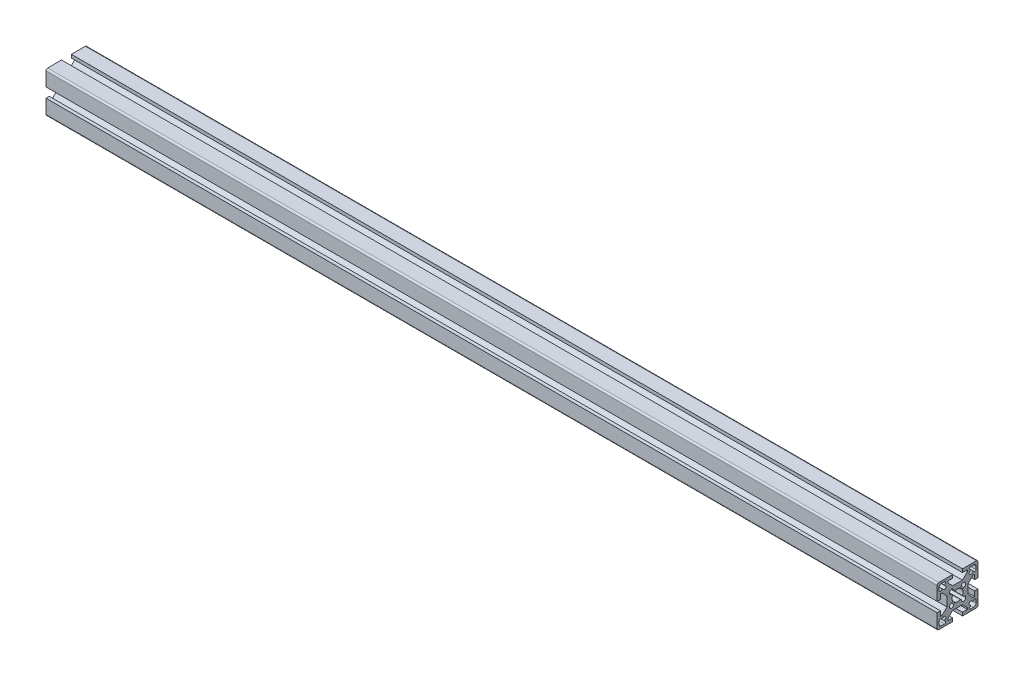
from build123d import *

# Parameters (mm, degrees)
BOSS_EXTRUDE1_DEPTH = 545


with BuildPart() as part:
    # Sketch1 → Boss-Extrude1 (new body)
    with BuildSketch(Plane(origin=(0, 0, 0), x_dir=(0, 0, -1), z_dir=(1, 0, 0))):
        with BuildLine():
            Line((-12.5, 11.5), (-12.5, 3))
            Line((-12.5, 3), (-10.5, 3))
            Line((-10.5, 3), (-10.5, 6))
            Line((-10.5, 6), (-9.535533906, 6))
            Line((-9.535533906, 6), (-6.5, 2.964466094))
            Line((-6.5, 2.964466094), (-6.5, -2.964466094))
            Line((-6.5, -2.964466094), (-9.535533906, -6))
            Line((-9.535533906, -6), (-10.5, -6))
            Line((-10.5, -6), (-10.5, -3))
            Line((-10.5, -3), (-12.5, -3))
            Line((-12.5, -3), (-12.5, -11.5))
            ThreePointArc((-12.5, -11.5), (-12.207106781, -12.207106781), (-11.5, -12.5))
            Line((-11.5, -12.5), (-3, -12.5))
            Line((-3, -12.5), (-3, -10.5))
            Line((-3, -10.5), (-6, -10.5))
            Line((-6, -10.5), (-6, -9.535533906))
            Line((-6, -9.535533906), (-2.964466094, -6.5))
            Line((-2.964466094, -6.5), (2.964466094, -6.5))
            Line((2.964466094, -6.5), (6, -9.535533906))
            Line((6, -9.535533906), (6, -10.5))
            Line((6, -10.5), (3, -10.5))
            Line((3, -10.5), (3, -12.5))
            Line((3, -12.5), (11.5, -12.5))
            ThreePointArc((11.5, -12.5), (12.207106781, -12.207106781), (12.5, -11.5))
            Line((12.5, -11.5), (12.5, -3))
            Line((12.5, -3), (10.5, -3))
            Line((10.5, -3), (10.5, -6))
            Line((10.5, -6), (9.535533906, -6))
            Line((9.535533906, -6), (6.5, -2.964466094))
            Line((6.5, -2.964466094), (6.5, 2.964466094))
            Line((6.5, 2.964466094), (9.535533906, 6))
            Line((9.535533906, 6), (10.5, 6))
            Line((10.5, 6), (10.5, 3))
            Line((10.5, 3), (12.5, 3))
            Line((12.5, 3), (12.5, 11.5))
            ThreePointArc((12.5, 11.5), (12.207106781, 12.207106781), (11.5, 12.5))
            Line((11.5, 12.5), (3, 12.5))
            Line((3, 12.5), (3, 10.5))
            Line((3, 10.5), (6, 10.5))
            Line((6, 10.5), (6, 9.535533906))
            Line((6, 9.535533906), (2.964466094, 6.5))
            Line((2.964466094, 6.5), (-2.964466094, 6.5))
            Line((-2.964466094, 6.5), (-6, 9.535533906))
            Line((-6, 9.535533906), (-6, 10.5))
            Line((-6, 10.5), (-3, 10.5))
            Line((-3, 10.5), (-3, 12.5))
            Line((-3, 12.5), (-11.5, 12.5))
            ThreePointArc((-11.5, 12.5), (-12.207106781, 12.207106781), (-12.5, 11.5))
        make_face()
        with BuildLine():
            Line((-3.087755464, -1.885673936), (-3.585519377, -2.383437849))
            ThreePointArc((-3.585519377, -2.383437849), (-4.599238816, -4.599238816), (-2.383437849, -3.585519377))
            Line((-2.383437849, -3.585519377), (-1.885673936, -3.087755464))
            ThreePointArc((-1.885673936, -3.087755464), (-1.720751743, -3.0036254), (-1.537849315, -3.032329053))
            ThreePointArc((-1.537849315, -3.032329053), (0, -3.4), (1.537849315, -3.032329053))
            ThreePointArc((1.537849315, -3.032329053), (1.720751743, -3.0036254), (1.885673936, -3.087755464))
            Line((1.885673936, -3.087755464), (2.383437849, -3.585519377))
            ThreePointArc((2.383437849, -3.585519377), (4.599238816, -4.599238816), (3.585519377, -2.383437849))
            Line((3.585519377, -2.383437849), (3.087755464, -1.885673936))
            ThreePointArc((3.087755464, -1.885673936), (3.0036254, -1.720751743), (3.032329053, -1.537849315))
            ThreePointArc((3.032329053, -1.537849315), (3.4, 0), (3.032329053, 1.537849315))
            ThreePointArc((3.032329053, 1.537849315), (3.0036254, 1.720751743), (3.087755464, 1.885673936))
            Line((3.087755464, 1.885673936), (3.585519377, 2.383437849))
            ThreePointArc((3.585519377, 2.383437849), (4.599238816, 4.599238816), (2.383437849, 3.585519377))
            Line((2.383437849, 3.585519377), (1.885673936, 3.087755464))
            ThreePointArc((1.885673936, 3.087755464), (1.720751743, 3.0036254), (1.537849315, 3.032329053))
            ThreePointArc((1.537849315, 3.032329053), (0, 3.4), (-1.537849315, 3.032329053))
            ThreePointArc((-1.537849315, 3.032329053), (-1.720751743, 3.0036254), (-1.885673936, 3.087755464))
            Line((-1.885673936, 3.087755464), (-2.383437849, 3.585519377))
            ThreePointArc((-2.383437849, 3.585519377), (-4.599238816, 4.599238816), (-3.585519377, 2.383437849))
            Line((-3.585519377, 2.383437849), (-3.087755464, 1.885673936))
            ThreePointArc((-3.087755464, 1.885673936), (-3.0036254, 1.720751743), (-3.032329053, 1.537849315))
            ThreePointArc((-3.032329053, 1.537849315), (-3.4, 0), (-3.032329053, -1.537849315))
            ThreePointArc((-3.032329053, -1.537849315), (-3.0036254, -1.720751743), (-3.087755464, -1.885673936))
        make_face(mode=Mode.SUBTRACT)
        with BuildLine():
            Line((-11.25, 9.75), (-11.25, 7.976197667))
            ThreePointArc((-11.25, 7.976197667), (-10.817878403, 7.329481994), (-10.055025253, 7.48122292))
            Line((-10.055025253, 7.48122292), (-9.475230868, 8.061017306))
            Line((-9.475230868, 8.061017306), (-8.768124087, 7.353910524))
            ThreePointArc((-8.768124087, 7.353910524), (-7.353910524, 7.353910524), (-7.353910524, 8.768124087))
            Line((-7.353910524, 8.768124087), (-8.061017306, 9.475230868))
            Line((-8.061017306, 9.475230868), (-7.48122292, 10.055025253))
            ThreePointArc((-7.48122292, 10.055025253), (-7.329481994, 10.817878403), (-7.976197667, 11.25))
            Line((-7.976197667, 11.25), (-9.75, 11.25))
            ThreePointArc((-9.75, 11.25), (-10.810660172, 10.810660172), (-11.25, 9.75))
        make_face(mode=Mode.SUBTRACT)
        with BuildLine():
            Line((8.061017306, 9.475230868), (7.353910524, 8.768124087))
            ThreePointArc((7.353910524, 8.768124087), (7.353910524, 7.353910524), (8.768124087, 7.353910524))
            Line((8.768124087, 7.353910524), (9.475230868, 8.061017306))
            Line((9.475230868, 8.061017306), (10.055025253, 7.48122292))
            ThreePointArc((10.055025253, 7.48122292), (10.817878403, 7.329481994), (11.25, 7.976197667))
            Line((11.25, 7.976197667), (11.25, 9.75))
            ThreePointArc((11.25, 9.75), (10.810660172, 10.810660172), (9.75, 11.25))
            Line((9.75, 11.25), (7.976197667, 11.25))
            ThreePointArc((7.976197667, 11.25), (7.329481994, 10.817878403), (7.48122292, 10.055025253))
            Line((7.48122292, 10.055025253), (8.061017306, 9.475230868))
        make_face(mode=Mode.SUBTRACT)
        with BuildLine():
            Line((-9.475230868, -8.061017306), (-10.055025253, -7.48122292))
            ThreePointArc((-10.055025253, -7.48122292), (-10.817878403, -7.329481994), (-11.25, -7.976197667))
            Line((-11.25, -7.976197667), (-11.25, -9.75))
            ThreePointArc((-11.25, -9.75), (-10.810660172, -10.810660172), (-9.75, -11.25))
            Line((-9.75, -11.25), (-7.976197667, -11.25))
            ThreePointArc((-7.976197667, -11.25), (-7.329481994, -10.817878403), (-7.48122292, -10.055025253))
            Line((-7.48122292, -10.055025253), (-8.061017306, -9.475230868))
            Line((-8.061017306, -9.475230868), (-7.353910524, -8.768124087))
            ThreePointArc((-7.353910524, -8.768124087), (-7.353910524, -7.353910524), (-8.768124087, -7.353910524))
            Line((-8.768124087, -7.353910524), (-9.475230868, -8.061017306))
        make_face(mode=Mode.SUBTRACT)
        with BuildLine():
            Line((9.475230868, -8.061017306), (8.768124087, -7.353910524))
            ThreePointArc((8.768124087, -7.353910524), (7.353910524, -7.353910524), (7.353910524, -8.768124087))
            Line((7.353910524, -8.768124087), (8.061017306, -9.475230868))
            Line((8.061017306, -9.475230868), (7.48122292, -10.055025253))
            ThreePointArc((7.48122292, -10.055025253), (7.329481994, -10.817878403), (7.976197667, -11.25))
            Line((7.976197667, -11.25), (9.75, -11.25))
            ThreePointArc((9.75, -11.25), (10.810660172, -10.810660172), (11.25, -9.75))
            Line((11.25, -9.75), (11.25, -7.976197667))
            ThreePointArc((11.25, -7.976197667), (10.817878403, -7.329481994), (10.055025253, -7.48122292))
            Line((10.055025253, -7.48122292), (9.475230868, -8.061017306))
        make_face(mode=Mode.SUBTRACT)
    extrude(amount=BOSS_EXTRUDE1_DEPTH)


solid = part.part
